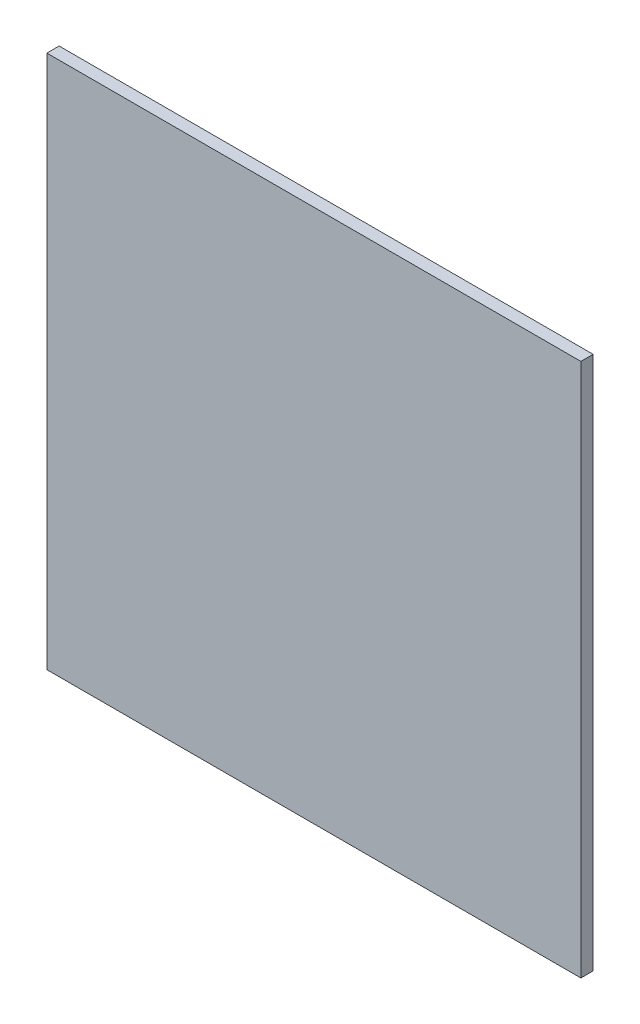
from build123d import *

# Parameters (mm, degrees)
SKIZZE1_W                       = 135
SKIZZE1_H                       = 135
AUFSATZ_LINEAR_AUSTRAGEN1_DEPTH = 3.1


with BuildPart() as part:
    # Skizze1 → Aufsatz-Linear austragen1 (new body)
    with BuildSketch(Plane.XY):
        Rectangle(SKIZZE1_W, SKIZZE1_H)
    extrude(amount=-AUFSATZ_LINEAR_AUSTRAGEN1_DEPTH)


solid = part.part
